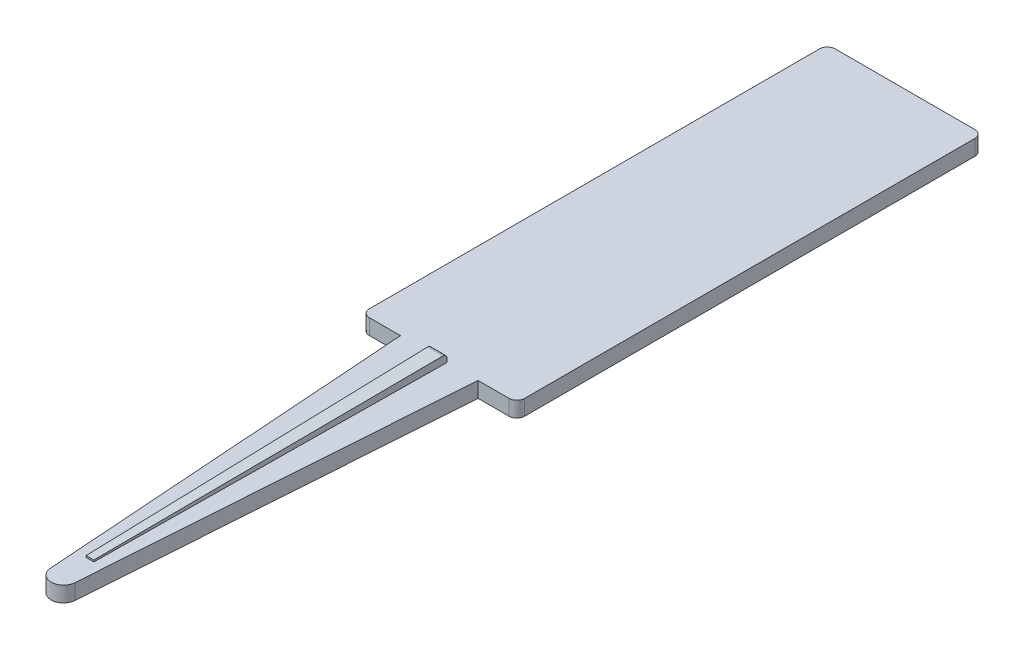
from build123d import *

# Parameters (mm, degrees)
BOSS_EXTRUDE1_DEPTH = 2
FILLET2_R           = 1
FILLET3_R           = 1
FILLET4_R           = 1
FILLET5_R           = 1
BOSS_EXTRUDE2_DEPTH = 1
DRAFT1_ANGLE        = -1
FILLET7_R           = 0.5


with BuildPart() as part:
    # Sketch1 → Boss-Extrude1 (new body)
    with BuildSketch(Plane(origin=(0, 0, 0), x_dir=(1, 0, 0), z_dir=(0, 1, 0))):
        with BuildLine():
            Line((0, 0), (20, 0))
            Line((20, 0), (20, -60))
            Line((20, -60), (15, -60))
            Line((15, -60), (11.6, -108.508220533))
            ThreePointArc((11.6, -108.508220533), (10, -110), (8.4, -108.508220533))
            Line((8.4, -108.508220533), (5, -60))
            Line((5, -60), (0, -60))
            Line((0, -60), (0, 0))
        make_face()
    extrude(amount=BOSS_EXTRUDE1_DEPTH)

    # Fillet2
    fillet2_edges = [part.edges().sort_by_distance(p)[0] for p in [
        (0, 1, 0),
    ]]
    fillet(fillet2_edges, radius=FILLET2_R)

    # Fillet3
    fillet3_edges = [part.edges().sort_by_distance(p)[0] for p in [
        (20, 1, 60),
    ]]
    fillet(fillet3_edges, radius=FILLET3_R)

    # Fillet4
    fillet4_edges = [part.edges().sort_by_distance(p)[0] for p in [
        (20, 1, 0),
    ]]
    fillet(fillet4_edges, radius=FILLET4_R)

    # Fillet5
    fillet5_edges = [part.edges().sort_by_distance(p)[0] for p in [
        (0, 1, 60),
    ]]
    fillet(fillet5_edges, radius=FILLET5_R)

    # Sketch5 → Boss-Extrude2 (add)
    with BuildSketch(Plane(origin=(0, 2, 0), x_dir=(1, 0, 0), z_dir=(0, 1, 0))):
        Polygon((11, -60), (9, -60), (9.5, -105), (10.5, -105), align=None)
    extrude(amount=BOSS_EXTRUDE2_DEPTH)

    # Draft1
    draft1_faces = [part.faces().sort_by_distance(p)[0] for p in [
        (10, 3, 80),
    ]]
    draft(draft1_faces, Plane(origin=(11, 3, 60), x_dir=(-1, 0, 0), z_dir=(0, 0, -1)), DRAFT1_ANGLE)

    # Fillet7
    fillet7_edges = [part.edges().sort_by_distance(p)[0] for p in [
        (10, 3, 60),
    ]]
    fillet(fillet7_edges, radius=FILLET7_R)


solid = part.part
